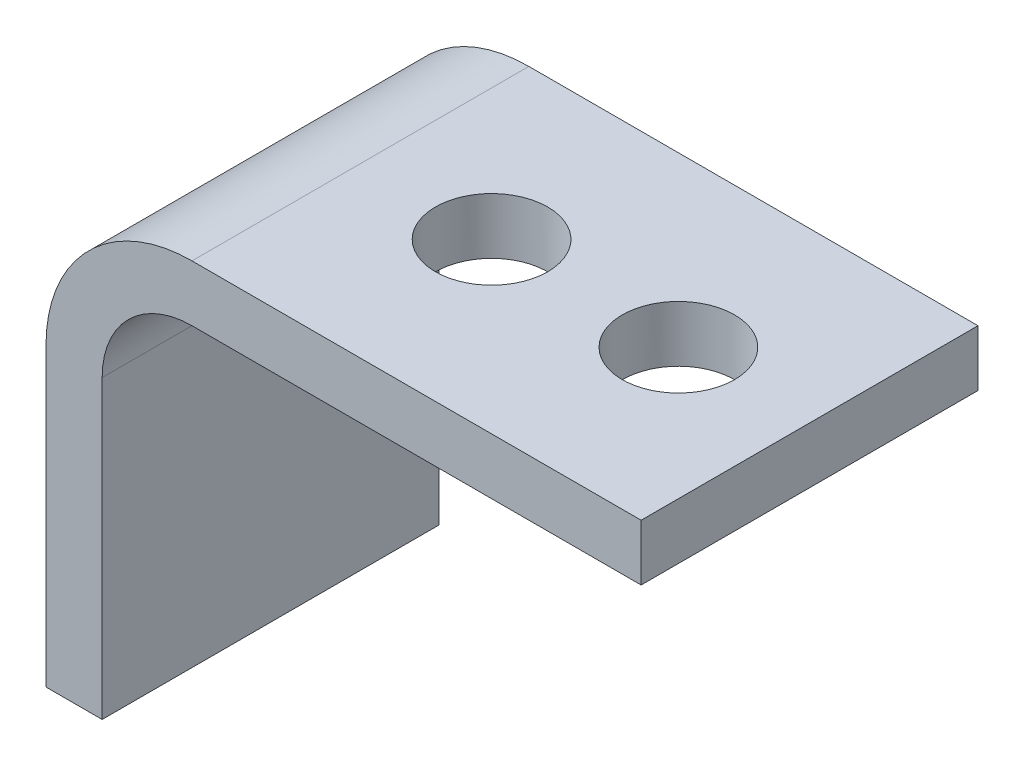
from build123d import *

# Parameters (mm, degrees)
BOSS_EXTRUDE1_DEPTH = 9.525
SKETCH2_R           = 0.75
CUT_EXTRUDE1_DEPTH  = 1.5875
CUT_EXTRUDE2_DEPTH  = 2.54


with BuildPart() as part:
    # Sketch1 → Boss-Extrude1 (new body)
    with BuildSketch(Plane.XY):
        with BuildLine():
            Line((0, 0), (0, 8.3725))
            ThreePointArc((0, 8.3725), (0.743948776, 10.168551224), (2.54, 10.9125))
            Line((2.54, 10.9125), (15.24, 10.9125))
            Line((15.24, 10.9125), (15.24, 12.5))
            Line((15.24, 12.5), (2.54, 12.5))
            ThreePointArc((2.54, 12.5), (-0.378583239, 11.291083239), (-1.5875, 8.3725))
            Line((-1.5875, 8.3725), (-1.5875, 0))
            Line((-1.5875, 0), (0, 0))
        make_face()
    extrude(amount=BOSS_EXTRUDE1_DEPTH)

    # Sketch2 → Cut-Extrude1 (cut)
    with BuildSketch(Plane(origin=(0, 0, 0), x_dir=(0, 0, -1), z_dir=(1, 0, 0))):
        with Locations((-2.25, 6.277)):
            Circle(SKETCH2_R)
    extrude(amount=-CUT_EXTRUDE1_DEPTH, mode=Mode.SUBTRACT)

    # Sketch3 → Cut-Extrude2 (cut)
    with BuildSketch(Plane.XZ.offset(-10.9125)):
        with BuildLine():
            ThreePointArc((4.6609, 4.7625), (6.2484, 3.175), (7.8359, 4.7625))
            Line((7.8359, 4.7625), (4.6609, 4.7625))
        make_face()
        with BuildLine():
            Line((4.6609, 4.7625), (7.8359, 4.7625))
            ThreePointArc((7.8359, 4.7625), (6.2484, 6.35), (4.6609, 4.7625))
        make_face()
        with BuildLine():
            ThreePointArc((9.9441, 4.7625), (11.5316, 3.175), (13.1191, 4.7625))
            Line((13.1191, 4.7625), (9.9441, 4.7625))
        make_face()
        with BuildLine():
            Line((9.9441, 4.7625), (13.1191, 4.7625))
            ThreePointArc((13.1191, 4.7625), (11.5316, 6.35), (9.9441, 4.7625))
        make_face()
    extrude(amount=-CUT_EXTRUDE2_DEPTH, mode=Mode.SUBTRACT)


solid = part.part
